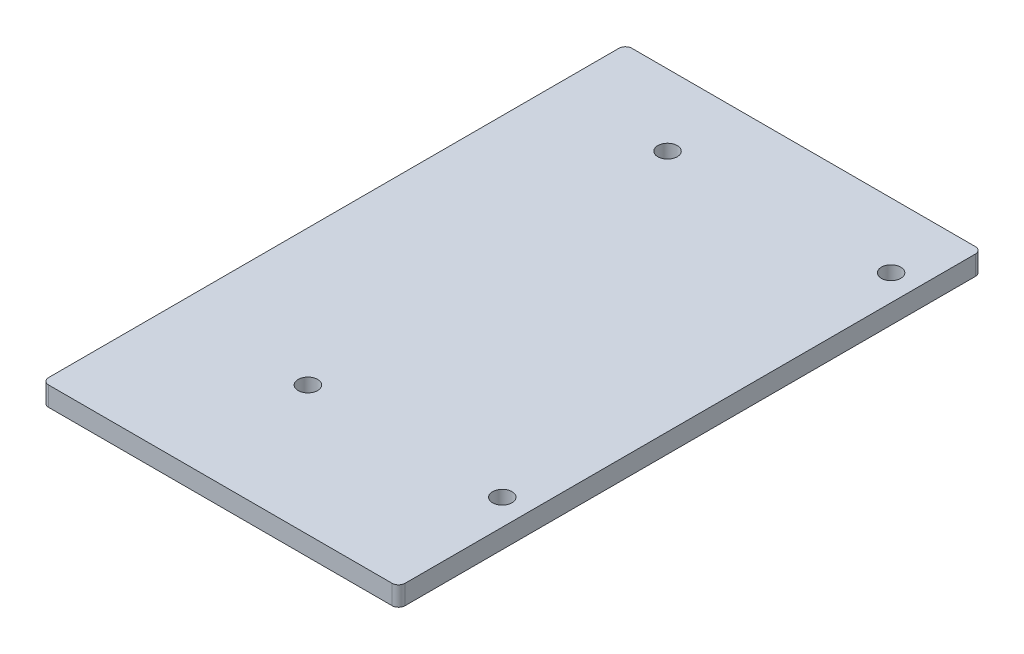
from build123d import *

# Parameters (mm, degrees)
SKETCH_1_W      = 55
SKETCH_1_H      = 90
SKETCH_1_R      = 1.5
EXTRUDE_1_DEPTH = 3
FILLET_1_R      = 1


with BuildPart() as part:
    # 草图1 → 凸台-拉伸1 (new body)
    with BuildSketch(Plane(origin=(0, 0, 0), x_dir=(1, 0, 0), z_dir=(0, 1, 0))):
        with Locations((27.5, -45)):
            Rectangle(SKETCH_1_W, SKETCH_1_H)
        with Locations(Location((17.5, -11, 0), (0, 0, 270))):
            Circle(SKETCH_1_R, mode=Mode.SUBTRACT)
        with Locations(Location((51, -10, 0), (0, 0, 270))):
            Circle(SKETCH_1_R, mode=Mode.SUBTRACT)
        with Locations(Location((21, -70, 0), (0, 0, 270))):
            Circle(SKETCH_1_R, mode=Mode.SUBTRACT)
        with Locations(Location((51, -70, 0), (0, 0, 270))):
            Circle(SKETCH_1_R, mode=Mode.SUBTRACT)
    extrude(amount=EXTRUDE_1_DEPTH)

    # 圆角1
    fillet_1_edges = [part.edges().sort_by_distance(p)[0] for p in [
        (0, 1.5, 0),
        (55, 1.5, 0),
        (55, 1.5, 90),
        (0, 1.5, 90),
    ]]
    fillet(fillet_1_edges, radius=FILLET_1_R)


solid = part.part
